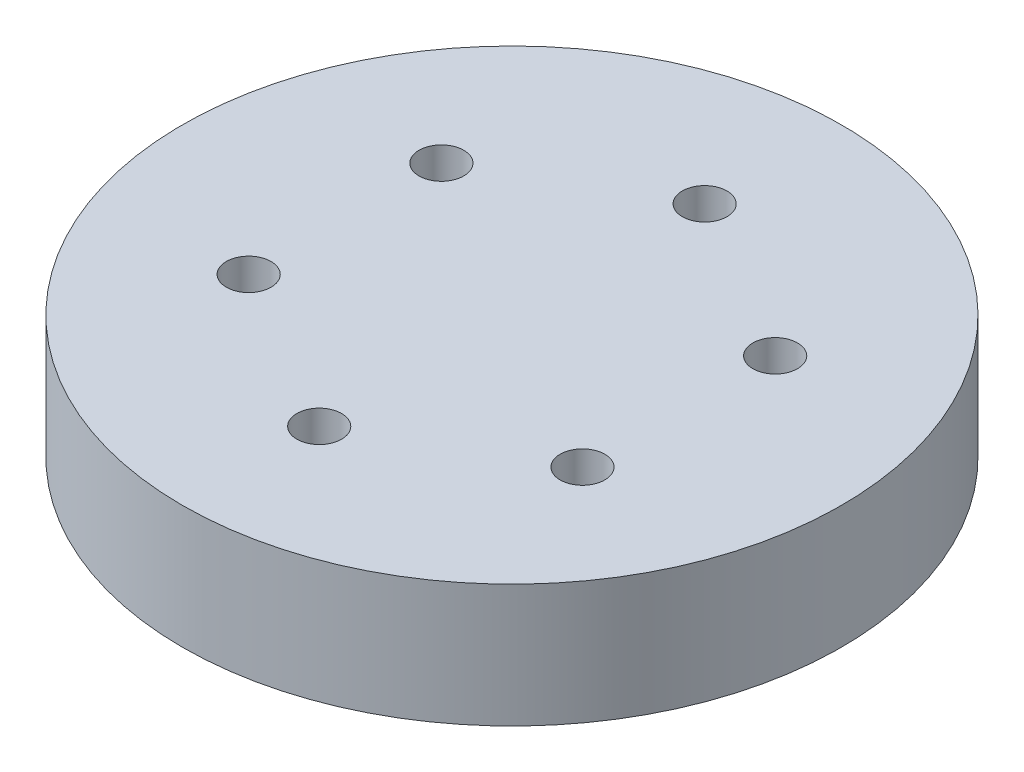
from build123d import *

# Parameters (mm, degrees)
SKETCH_1_R      = 29.5
SKETCH_1_R_2    = 2
EXTRUDE_1_DEPTH = 11


with BuildPart() as part:
    # 草图1 → 凸台-拉伸1 (new body)
    with BuildSketch(Plane(origin=(0, 0, 0), x_dir=(1, 0, 0), z_dir=(0, 1, 0))):
        with Locations(Location((0, 0, 0), (0, 0, 270))):
            Circle(SKETCH_1_R)
        with Locations(Location((0, 17.25, 0), (0, 0, 270))):
            Circle(SKETCH_1_R_2, mode=Mode.SUBTRACT)
        with Locations(Location((14.938938215, 8.625, 0), (0, 0, 270))):
            Circle(SKETCH_1_R_2, mode=Mode.SUBTRACT)
        with Locations(Location((14.938938215, -8.625, 0), (0, 0, 270))):
            Circle(SKETCH_1_R_2, mode=Mode.SUBTRACT)
        with Locations(Location((0, -17.25, 0), (0, 0, 270))):
            Circle(SKETCH_1_R_2, mode=Mode.SUBTRACT)
        with Locations(Location((-14.938938215, -8.625, 0), (0, 0, 270))):
            Circle(SKETCH_1_R_2, mode=Mode.SUBTRACT)
        with Locations(Location((-14.938938215, 8.625, 0), (0, 0, 270))):
            Circle(SKETCH_1_R_2, mode=Mode.SUBTRACT)
    extrude(amount=EXTRUDE_1_DEPTH)


solid = part.part
